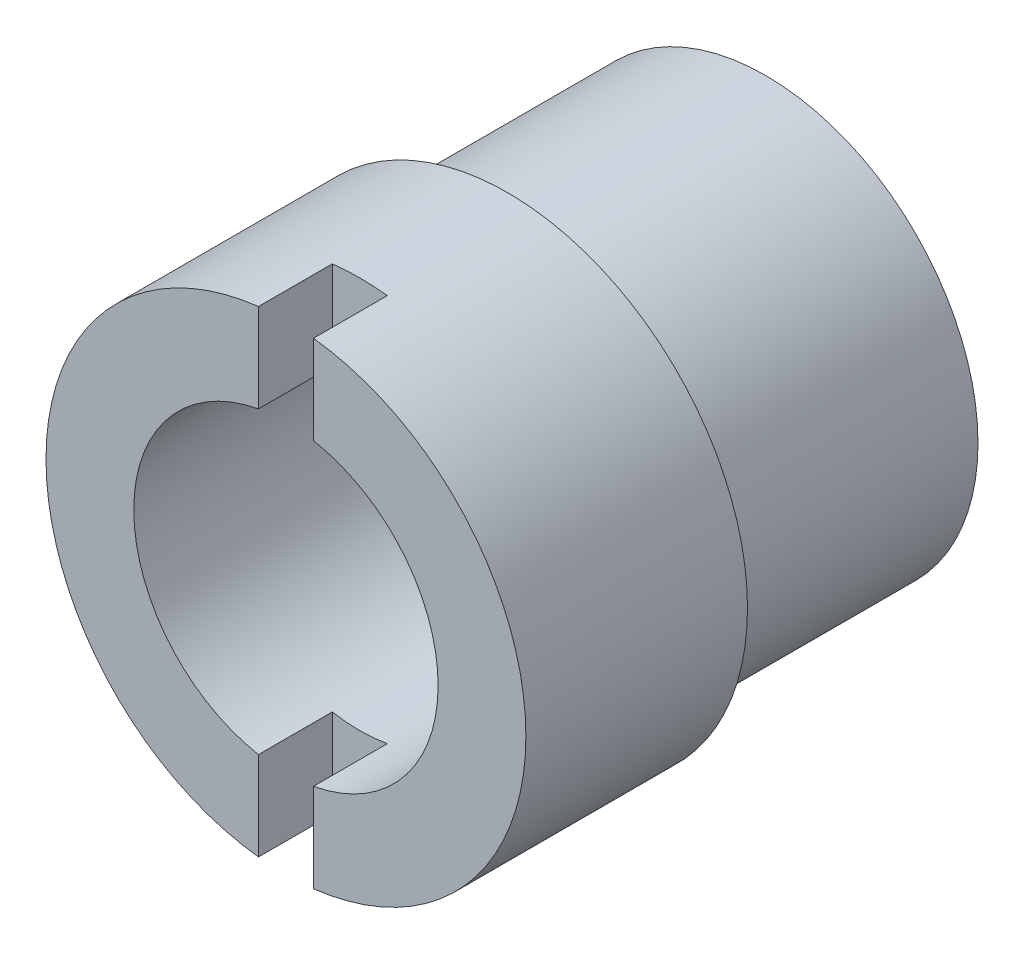
from build123d import *

# Parameters (mm, degrees)
SKETCH1_R               = 10.3124
SKETCH1_R_2             = 6.5405
BOSS_EXTRUDE1_DEPTH     = 9.525
BOSS_EXTRUDE2_START     = 11.0998
SKETCH2_R               = 9.1186
SKETCH2_R_2             = 6.5405
BOSS_EXTRUDE2_DEPTH     = 11.0998
CUT_EXTRUDE1_DEPTH      = 19.327486122
CUT_EXTRUDE1_DEPTH_BACK = 19.327486122
SKETCH3_W               = 2.3622
SKETCH3_H               = 3.175


with BuildPart() as part:
    # Sketch1 → Boss-Extrude1 (new body)
    with BuildSketch(Plane.XY):
        with Locations(Location((0, 0, 0), (0, 0, 180))):
            Circle(SKETCH1_R)
        with Locations(Location((0, 0, 0), (0, 0, 180))):
            Circle(SKETCH1_R_2, mode=Mode.SUBTRACT)
    extrude(amount=BOSS_EXTRUDE1_DEPTH)

    # Sketch2 → Boss-Extrude2 (add)
    with BuildSketch(Plane(origin=(0, 0, 0), x_dir=(-1, 0, 0), z_dir=(0, 0, -1)).offset(BOSS_EXTRUDE2_START)):
        Circle(SKETCH2_R)
        Circle(SKETCH2_R_2, mode=Mode.SUBTRACT)
    extrude(amount=-BOSS_EXTRUDE2_DEPTH)

    # Sketch3 → Cut-Extrude1 (cut, two sides: drawn at the far end of the back side and taken through both)
    with BuildSketch(Plane(origin=(0, 0, 0), x_dir=(1, 0, 0), z_dir=(0, 1, 0)).offset(-CUT_EXTRUDE1_DEPTH_BACK)):
        with Locations((0, -7.9375)):
            Rectangle(SKETCH3_W, SKETCH3_H)
    extrude(amount=CUT_EXTRUDE1_DEPTH + CUT_EXTRUDE1_DEPTH_BACK, mode=Mode.SUBTRACT)


solid = part.part
